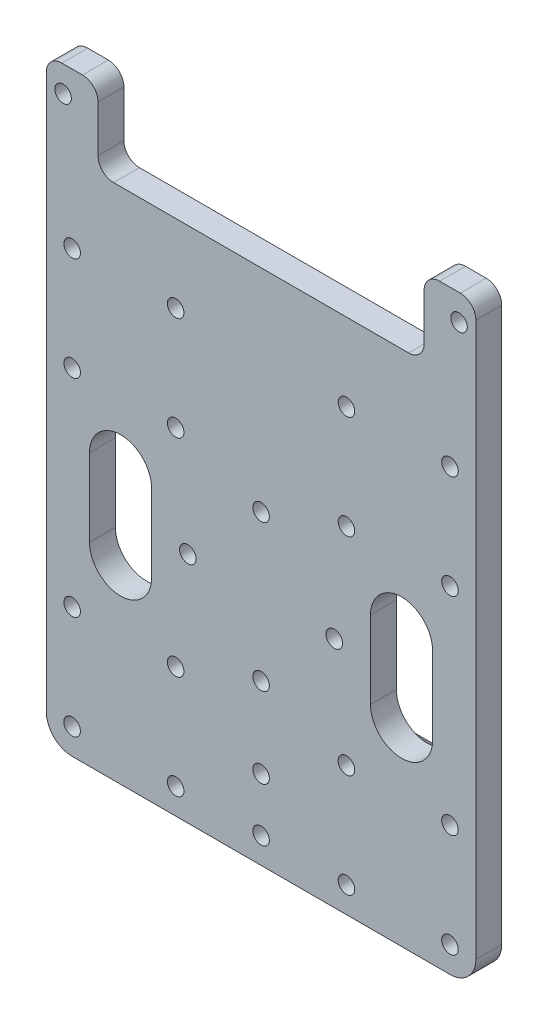
from build123d import *

# Parameters (mm, degrees)
SKETCH_1_R          = 1.6
EXTRUDE_1_DEPTH     = 5
SKETCH_7_R          = 1.6
EXTRUDE_3_DEPTH     = 5
CUT_EXTRUDE_1_DEPTH = 82.530669076
EXTRUDE_4_DEPTH     = 5
SKETCH_10_R         = 1.6
CUT_EXTRUDE_2_DEPTH = 5
SKETCH_11_R         = 1.3
CUT_EXTRUDE_3_DEPTH = 87.73090568


with BuildPart() as part:
    # ｽｹｯﾁ1 → ﾎﾞｽ - 押し出し1 (new body)
    with BuildSketch(Plane.XY):
        with BuildLine():
            Line((36.5, -45), (-36.5, -45))
            ThreePointArc((-36.5, -45), (-40.035533906, -43.535533906), (-41.5, -40))
            Line((-41.5, -40), (-41.5, 40))
            ThreePointArc((-41.5, 40), (-40.035533906, 43.535533906), (-36.5, 45))
            Line((-36.5, 45), (36.5, 45))
            ThreePointArc((36.5, 45), (40.035533906, 43.535533906), (41.5, 40))
            Line((41.5, 40), (41.5, -40))
            ThreePointArc((41.5, -40), (40.035533906, -43.535533906), (36.5, -45))
        make_face()
        with Locations((16.5, 40)):
            Circle(SKETCH_1_R, mode=Mode.SUBTRACT)
        with Locations((16.5, 20)):
            Circle(SKETCH_1_R, mode=Mode.SUBTRACT)
        with Locations((36.5, 20)):
            Circle(SKETCH_1_R, mode=Mode.SUBTRACT)
        with Locations((36.5, 40)):
            Circle(SKETCH_1_R, mode=Mode.SUBTRACT)
        with Locations(Location((36.5, -40, 0), (0, 0, 180))):
            Circle(SKETCH_1_R, mode=Mode.SUBTRACT)
        with Locations(Location((36.5, -20, 0), (0, 0, 180))):
            Circle(SKETCH_1_R, mode=Mode.SUBTRACT)
        with Locations(Location((16.5, -20, 0), (0, 0, 180))):
            Circle(SKETCH_1_R, mode=Mode.SUBTRACT)
        with Locations(Location((16.5, -40, 0), (0, 0, 180))):
            Circle(SKETCH_1_R, mode=Mode.SUBTRACT)
        with Locations((-16.5, -40)):
            Circle(SKETCH_1_R, mode=Mode.SUBTRACT)
        with Locations((-16.5, -20)):
            Circle(SKETCH_1_R, mode=Mode.SUBTRACT)
        with Locations((-36.5, -20)):
            Circle(SKETCH_1_R, mode=Mode.SUBTRACT)
        with Locations((-36.5, -40)):
            Circle(SKETCH_1_R, mode=Mode.SUBTRACT)
        with Locations(Location((-36.5, 40, 0), (0, 0, 180))):
            Circle(SKETCH_1_R, mode=Mode.SUBTRACT)
        with Locations(Location((-36.5, 20, 0), (0, 0, 180))):
            Circle(SKETCH_1_R, mode=Mode.SUBTRACT)
        with Locations(Location((-16.5, 20, 0), (0, 0, 180))):
            Circle(SKETCH_1_R, mode=Mode.SUBTRACT)
        with Locations(Location((-16.5, 40, 0), (0, 0, 180))):
            Circle(SKETCH_1_R, mode=Mode.SUBTRACT)
        with Locations((14.142135624, 0)):
            Circle(SKETCH_1_R, mode=Mode.SUBTRACT)
        with Locations((0, -14.142135624)):
            Circle(SKETCH_1_R, mode=Mode.SUBTRACT)
        with Locations((-14.142135624, 0)):
            Circle(SKETCH_1_R, mode=Mode.SUBTRACT)
        with Locations((0, 14.142135624)):
            Circle(SKETCH_1_R, mode=Mode.SUBTRACT)
    extrude(amount=EXTRUDE_1_DEPTH)

    # ｽｹｯﾁ7 → ﾎﾞｽ - 押し出し3 (add)
    with BuildSketch(Plane(origin=(0, 0, 0), x_dir=(-1, 0, 0), z_dir=(0, 0, -1))):
        with BuildLine():
            Line((-41.5, 40), (-41.5, 67))
            ThreePointArc((-41.5, 67), (-40.621320344, 69.121320344), (-38.5, 70))
            Line((-38.5, 70), (-34.5, 70))
            ThreePointArc((-34.5, 70), (-32.378679656, 69.121320344), (-31.5, 67))
            Line((-31.5, 67), (-31.5, 58))
            ThreePointArc((-31.5, 58), (-30.621320344, 55.878679656), (-28.5, 55))
            Line((-28.5, 55), (28.5, 55))
            ThreePointArc((28.5, 55), (30.621320344, 55.878679656), (31.5, 58))
            Line((31.5, 58), (31.5, 67))
            ThreePointArc((31.5, 67), (32.378679656, 69.121320344), (34.5, 70))
            Line((34.5, 70), (38.5, 70))
            ThreePointArc((38.5, 70), (40.621320344, 69.121320344), (41.5, 67))
            Line((41.5, 67), (41.5, 40))
            ThreePointArc((41.5, 40), (40.035533906, 43.535533906), (36.5, 45))
            Line((36.5, 45), (-36.5, 45))
            ThreePointArc((-36.5, 45), (-40.035533906, 43.535533906), (-41.5, 40))
        make_face()
        with Locations((-38.25, 65)):
            Circle(SKETCH_7_R, mode=Mode.SUBTRACT)
        with Locations((38.25, 65)):
            Circle(SKETCH_7_R, mode=Mode.SUBTRACT)
    extrude(amount=-EXTRUDE_3_DEPTH)

    # ｽｹｯﾁ8 → ｶｯﾄ - 押し出し1 (cut, through all)
    with BuildSketch(Plane(origin=(0, 0, 0), x_dir=(-1, 0, 0), z_dir=(0, 0, -1))):
        with BuildLine():
            Line((-33.142135624, -7.5), (-33.142135624, 7.5))
            ThreePointArc((-33.142135624, 7.5), (-27.142135624, 13.5), (-21.142135624, 7.5))
            Line((-21.142135624, 7.5), (-21.142135624, -7.5))
            ThreePointArc((-21.142135624, -7.5), (-27.142135624, -13.5), (-33.142135624, -7.5))
        make_face()
        with BuildLine():
            Line((33.142135624, -7.5), (33.142135624, 7.5))
            ThreePointArc((33.142135624, 7.5), (27.142135624, 13.5), (21.142135624, 7.5))
            Line((21.142135624, 7.5), (21.142135624, -7.5))
            ThreePointArc((21.142135624, -7.5), (27.142135624, -13.5), (33.142135624, -7.5))
        make_face()
    extrude(amount=-CUT_EXTRUDE_1_DEPTH, mode=Mode.SUBTRACT)

    # ｽｹｯﾁ10 → ｶｯﾄ - 押し出し2 (cut)
    with BuildSketch(Plane.XY.offset(5)):
        with Locations((0, -29.673664184)):
            Circle(SKETCH_10_R)
        with Locations((0, -40)):
            Circle(SKETCH_10_R)
    extrude(amount=-CUT_EXTRUDE_2_DEPTH, mode=Mode.SUBTRACT)


with BuildPart() as body_2:
    # ｽｹｯﾁ9 → ﾎﾞｽ - 押し出し4 (new, symmetric)
    with BuildSketch(Plane(origin=(0, 0, 0), x_dir=(0, 0, -1), z_dir=(1, 0, 0))):
        Polygon((0, -25), (0, -50), (30, -50), (30, -43), (7, -25), align=None)
    extrude(amount=EXTRUDE_4_DEPTH, both=True)

    # ｽｹｯﾁ11 → ｶｯﾄ - 押し出し3 (cut, through all)
    with BuildSketch(Plane.XY):
        with Locations((0, -29.673664184)):
            Circle(SKETCH_11_R)
        with Locations((0, -40)):
            Circle(SKETCH_11_R)
    extrude(amount=-CUT_EXTRUDE_3_DEPTH, mode=Mode.SUBTRACT)


solid = Compound([part.part, body_2.part])
